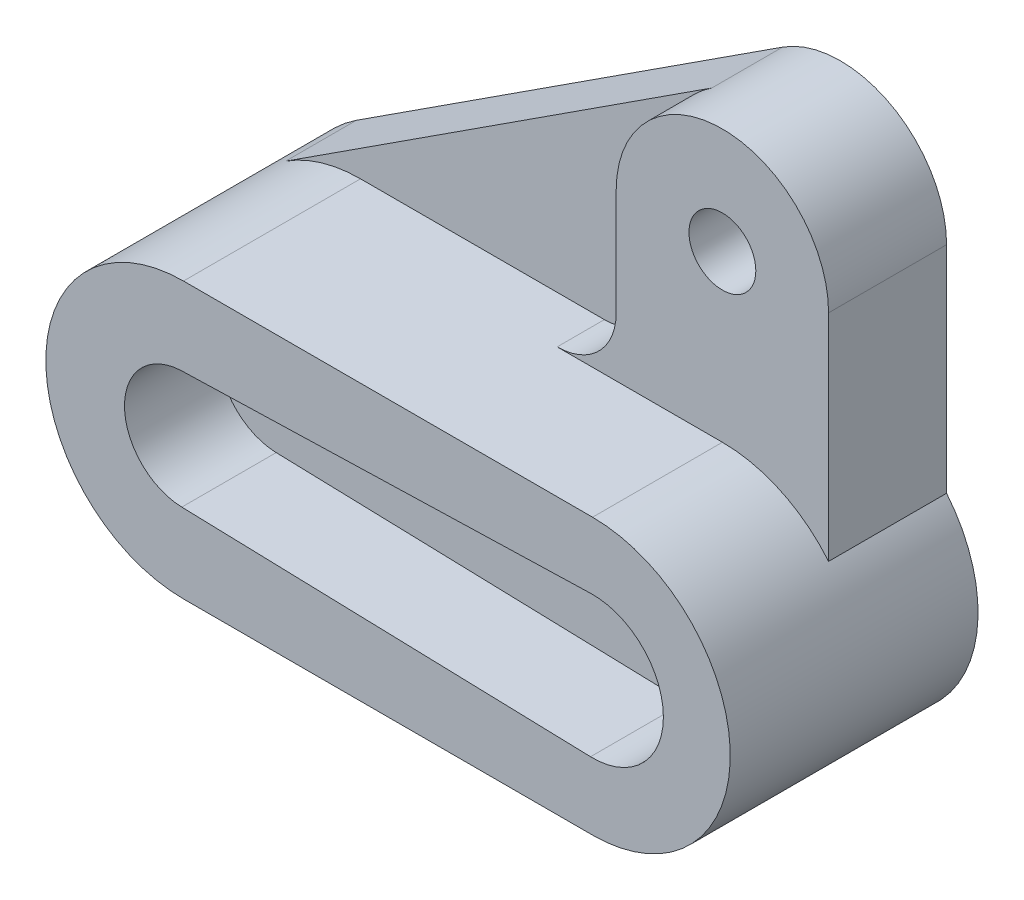
from build123d import *

# Parameters (mm, degrees)
BOSS_EXTRUDE3_DEPTH      = 48
BOSS_EXTRUDE3_DEPTH_BACK = 15
BOSS_EXTRUDE4_DEPTH      = 24
BOSS_EXTRUDE5_DEPTH      = 15
BOSS_EXTRUDE5_DEPTH_BACK = 15
SKETCH2_6_R              = 8.5
BOSS_EXTRUDE6_DEPTH      = 3
BOSS_EXTRUDE6_DEPTH_BACK = 15


with BuildPart() as part:
    # Sketch2 → Boss-Extrude3 (new, two sides: drawn at the far end of the back side and taken through both)
    with BuildSketch(Plane.XY.offset(-BOSS_EXTRUDE3_DEPTH_BACK)):
        with BuildLine():
            Line((3.747556009, 35), (-58.252443991, 35))
            ThreePointArc((-58.252443991, 35), (-68.184558925, 33.56118432), (-77.300074847, 29.363033883))
            ThreePointArc((-77.300074847, 29.363033883), (-91.813628311, -9.932114934), (-58.252443991, -35))
            Line((-58.252443991, -35), (45.747556009, -35))
            ThreePointArc((45.747556009, -35), (77.405785672, -14.925029132), (72.747556009, 22.271057451))
            ThreePointArc((72.747556009, 22.271057451), (60.672585141, 31.658229663), (45.747556009, 35))
            Line((45.747556009, 35), (3.747556009, 35))
        make_face()
        with BuildLine():
            Line((-58.685136299, 14.993757947), (45.22832524, 17.992509536))
            ThreePointArc((45.22832524, 17.992509536), (63.747556009, 0), (45.22832524, -17.992509536))
            Line((45.22832524, -17.992509536), (-58.685136299, -14.993757947))
            ThreePointArc((-58.685136299, -14.993757947), (-73.252443991, 0), (-58.685136299, 14.993757947))
        make_face(mode=Mode.SUBTRACT)
    extrude(amount=BOSS_EXTRUDE3_DEPTH + BOSS_EXTRUDE3_DEPTH_BACK)

    # Sketch2<5> → Boss-Extrude4 (add)
    with BuildSketch(Plane.XY):
        with BuildLine():
            ThreePointArc((45.22832524, -17.992509536), (63.747556009, 0), (45.22832524, 17.992509536))
            Line((45.22832524, 17.992509536), (-58.685136299, 14.993757947))
            ThreePointArc((-58.685136299, 14.993757947), (-73.252443991, 0), (-58.685136299, -14.993757947))
            Line((-58.685136299, -14.993757947), (45.22832524, -17.992509536))
        make_face()
    extrude(amount=BOSS_EXTRUDE4_DEPTH)

    # Sketch2<6> → Boss-Extrude5 (add, two sides: drawn at the far end of the back side and taken through both)
    with BuildSketch(Plane.XY.offset(-BOSS_EXTRUDE5_DEPTH_BACK)):
        with BuildLine():
            ThreePointArc((18.747556009, 50), (14.354157727, 39.393398282), (3.747556009, 35))
            Line((3.747556009, 35), (45.747556009, 35))
            ThreePointArc((45.747556009, 35), (60.672585141, 31.658229663), (72.747556009, 22.271057451))
            Line((72.747556009, 22.271057451), (72.747556009, 77))
            ThreePointArc((72.747556009, 77), (58.636796874, 100.724828132), (31.053669349, 99.651483281))
            ThreePointArc((31.053669349, 99.651483281), (22.022727876, 89.889240866), (18.747556009, 77))
            Line((18.747556009, 77), (18.747556009, 50))
        make_face()
        with Locations((45.747556009, 77)):
            Circle(SKETCH2_6_R, mode=Mode.SUBTRACT)
    extrude(amount=BOSS_EXTRUDE5_DEPTH + BOSS_EXTRUDE5_DEPTH_BACK)

    # Sketch2<7> → Boss-Extrude6 (add, two sides: drawn at the far end of the back side and taken through both)
    with BuildSketch(Plane.XY.offset(-BOSS_EXTRUDE6_DEPTH_BACK)):
        with BuildLine():
            ThreePointArc((-77.300074847, 29.363033883), (-68.184558925, 33.56118432), (-58.252443991, 35))
            Line((-58.252443991, 35), (3.747556009, 35))
            ThreePointArc((3.747556009, 35), (14.354157727, 39.393398282), (18.747556009, 50))
            Line((18.747556009, 50), (18.747556009, 77))
            ThreePointArc((18.747556009, 77), (22.022727876, 89.889240866), (31.053669349, 99.651483281))
            Line((31.053669349, 99.651483281), (-77.300074847, 29.363033883))
        make_face()
    extrude(amount=BOSS_EXTRUDE6_DEPTH + BOSS_EXTRUDE6_DEPTH_BACK)


solid = part.part
